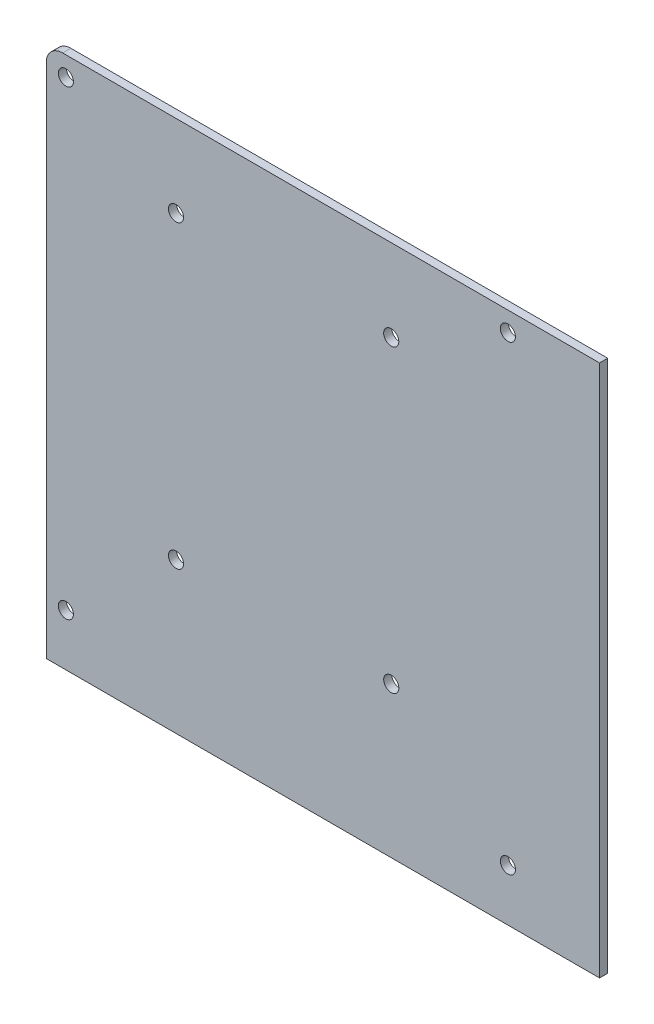
from build123d import *

# Parameters (mm, degrees)
SKETCH1_W            = 254
SKETCH1_H            = 381
BOSS_EXTRUDE1_DEPTH  = 1.5875
SKETCH2_R            = 1.4732
CUT_EXTRUDE1_DEPTH   = 458.907763809
FILLET1_R            = 3.175
SKETCH5_R            = 1.4732
CUT_EXTRUDE3_DEPTH   = 458.907763809
LPATTERN1_COUNT      = 4
LPATTERN1_PITCH      = 96.8756
LPATTERN1_COUNT_DIR2 = 2
LPATTERN1_PITCH_DIR2 = 161.5948
CUT_EXTRUDE4_DEPTH   = 458.907763809


with BuildPart() as part:
    # Sketch1 → Boss-Extrude1 (new body)
    with BuildSketch(Plane.XY):
        with Locations((127, 190.5)):
            Rectangle(SKETCH1_W, SKETCH1_H)
    extrude(amount=BOSS_EXTRUDE1_DEPTH)

    # Sketch2 → Cut-Extrude1 (cut, through all)
    with BuildSketch(Plane.XY.offset(1.5875)):
        with Locations((3.81, 377.19)):
            Circle(SKETCH2_R)
        with Locations(Location((89.8652, 377.19, 0), (0, 0, 180))):
            Circle(SKETCH2_R)
        with Locations(Location((164.1348, 377.19, 0), (0, 0, 180))):
            Circle(SKETCH2_R)
        with Locations((250.19, 377.19)):
            Circle(SKETCH2_R)
        with Locations(Location((164.1348, 287.375451288, 0), (0, 0, 180))):
            Circle(SKETCH2_R)
        with Locations((3.81, 287.3756)):
            Circle(SKETCH2_R)
        with Locations((250.19, 287.3756)):
            Circle(SKETCH2_R)
        with Locations((89.8652, 287.3756)):
            Circle(SKETCH2_R)
        with Locations(Location((164.1348, 190.499990436, 0), (0, 0, 180))):
            Circle(SKETCH2_R)
        with Locations((3.81, 191.135)):
            Circle(SKETCH2_R)
        with Locations((250.19, 190.5)):
            Circle(SKETCH2_R)
        with Locations((89.8652, 190.5)):
            Circle(SKETCH2_R)
        with Locations(Location((164.1348, 93.6244, 0), (0, 0, 180))):
            Circle(SKETCH2_R)
        with Locations((3.81, 93.6244)):
            Circle(SKETCH2_R)
        with Locations((250.19, 93.6244)):
            Circle(SKETCH2_R)
        with Locations((89.8652, 93.6244)):
            Circle(SKETCH2_R)
        with Locations(Location((164.1348, 3.81, 0), (0, 0, 180))):
            Circle(SKETCH2_R)
        with Locations((3.81, 3.81)):
            Circle(SKETCH2_R)
        with Locations((250.19, 3.81)):
            Circle(SKETCH2_R)
        with Locations((89.8652, 3.81)):
            Circle(SKETCH2_R)
    extrude(amount=-CUT_EXTRUDE1_DEPTH, mode=Mode.SUBTRACT)

    # Fillet1
    fillet1_edges = [part.edges().sort_by_distance(p)[0] for p in [
        (0, 381, 0.79375),
        (254, 381, 0.79375),
        (254, 0, 0.79375),
        (0, 0, 0.79375),
    ]]
    fillet(fillet1_edges, radius=FILLET1_R)

    # Sketch5 → Cut-Extrude3 (cut, through all)
    with BuildSketch(Plane.XY.offset(1.5875)):
        with Locations((25.2476, 74.3966)):
            Circle(SKETCH5_R)
        with Locations(Location((67.1576, 74.3966, 0), (0, 0, 180))):
            Circle(SKETCH5_R)
        with Locations((67.1576, 15.9766)):
            Circle(SKETCH5_R)
        with Locations(Location((25.2476, 15.9766, 0), (0, 0, 180))):
            Circle(SKETCH5_R)
    cut_extrude3 = extrude(amount=-CUT_EXTRUDE3_DEPTH, mode=Mode.SUBTRACT)

    # LPattern1: Cut-Extrude3 4 × 2
    with Locations(*[(j * LPATTERN1_PITCH_DIR2, i * LPATTERN1_PITCH, 0) for i in range(LPATTERN1_COUNT) for j in range(LPATTERN1_COUNT_DIR2) if (i, j) != (0, 0)]):
        add(cut_extrude3, mode=Mode.SUBTRACT)

    # Sketch6 → Cut-Extrude4 (cut, through all)
    with BuildSketch(Plane.XY.offset(1.5875)):
        Polygon((295.552123895, 381), (107.714500619, 381), (107.714500619, 277.29497196), (0, 277.29497196), (0, -37.89474057), (295.552123895, -37.89474057), align=None)
    extrude(amount=-CUT_EXTRUDE4_DEPTH, mode=Mode.SUBTRACT)


solid = part.part
